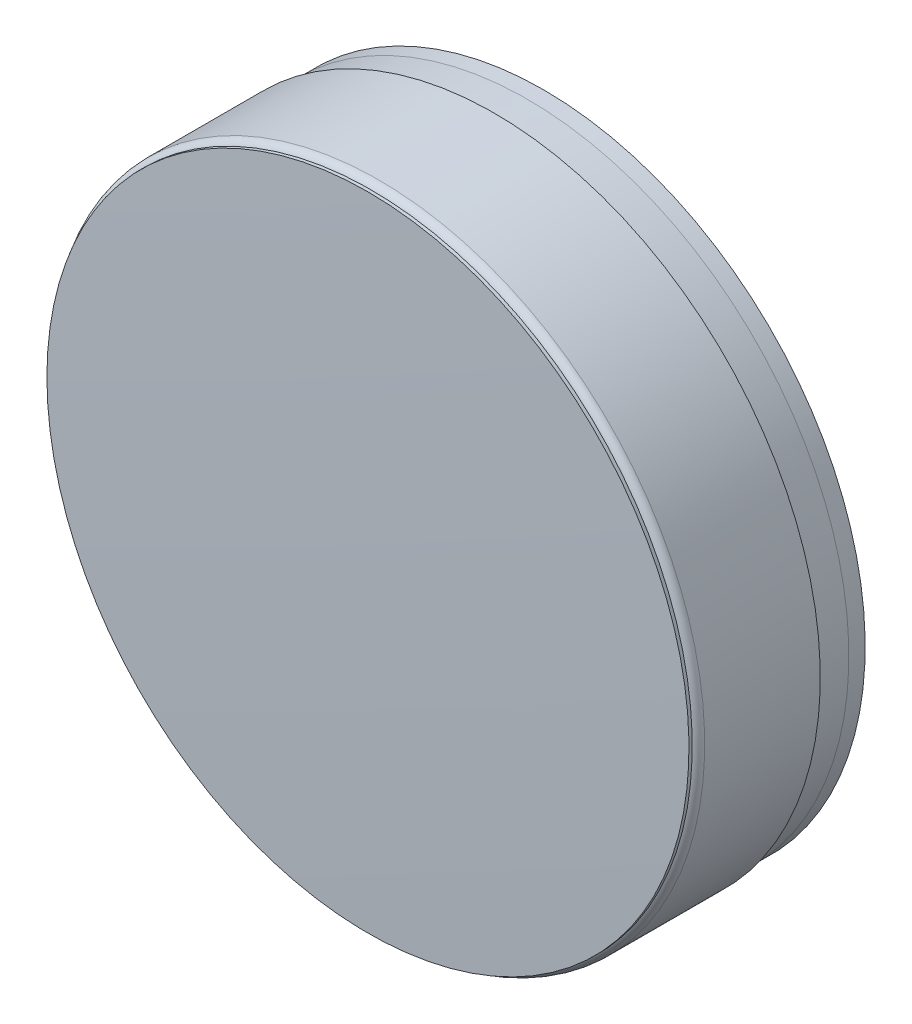
from build123d import *


with BuildPart() as part:
    # Sketch1 → Revolve1 (revolve)
    with BuildSketch(Plane(origin=(0, 0, 0), x_dir=(0, 0, -1), z_dir=(1, 0, 0)), mode=Mode.PRIVATE) as revolve1_sk:
        with BuildLine():
            Line((0, 0), (3, 0))
            ThreePointArc((3, 0), (2.938994507, 2.469175495), (2.756126895, 4.932325659))
            Line((2.756126895, 4.932325659), (2.506126895, 4.932325659))
            Line((2.506126895, 4.932325659), (2, 4.95))
            Line((2, 4.95), (2, 5))
            Line((2, 5), (0.22651456, 5))
            ThreePointArc((0.22651456, 5), (0.157503692, 4.979613789), (0.110648258, 4.925))
            Line((0.110648258, 4.925), (0.060648258, 4.925))
            ThreePointArc((0.060648258, 4.925), (0.015162639, 2.462686704), (0, 0))
        make_face()
    revolve(revolve1_sk.sketch.rotate(Axis((0, 0, -7.414080755), (0, 0, 1)), 90), axis=Axis((0, 0, -7.414080755), (0, 0, 1)))


solid = part.part
